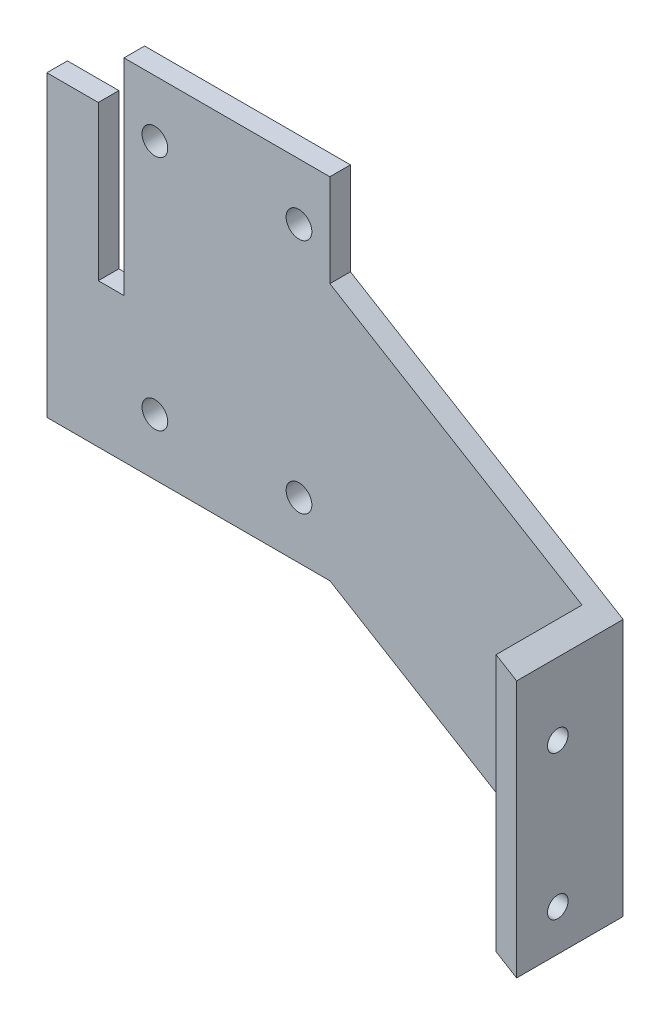
from build123d import *

# Parameters (mm, degrees)
SKETCH_1_R          = 2.5
EXTRUDE_1_DEPTH     = 4
EXTRUDE_2_DEPTH     = 16.7
SKETCH_3_R          = 2
CUT_EXTRUDE_1_DEPTH = 10
CUT_EXTRUDE_2_DEPTH = 10


with BuildPart() as part:
    # Эскиз1 → Бобышка-Вытянуть1 (new body)
    with BuildSketch(Plane.XY):
        Polygon((0, 0), (55, 0), (108, -32), (108, 0), (108, 18), (55, 50), (55, 68), (0, 68), align=None)
        with Locations((21, 57)):
            Circle(SKETCH_1_R, mode=Mode.SUBTRACT)
        with Locations((49, 57)):
            Circle(SKETCH_1_R, mode=Mode.SUBTRACT)
        with Locations((21, 11)):
            Circle(SKETCH_1_R, mode=Mode.SUBTRACT)
        with Locations((49, 11)):
            Circle(SKETCH_1_R, mode=Mode.SUBTRACT)
        with Locations((93, 0)):
            Circle(SKETCH_1_R, mode=Mode.SUBTRACT)
    extrude(amount=EXTRUDE_1_DEPTH)

    # Эскиз2 → Бобышка-Вытянуть2 (add)
    with BuildSketch(Plane.XY.offset(4)):
        Polygon((108, 18), (108, -32), (104, -29.58490566), (104, 20.41509434), align=None)
    extrude(amount=EXTRUDE_2_DEPTH)

    # Эскиз3 → Вырез-Вытянуть1 (cut)
    with BuildSketch(Plane(origin=(108, 0, 0), x_dir=(0, 0, -1), z_dir=(1, 0, 0))):
        with Locations((-12.7, 4)):
            Circle(SKETCH_3_R)
        with Locations((-12.7, -24)):
            Circle(SKETCH_3_R)
    extrude(amount=-CUT_EXTRUDE_1_DEPTH, mode=Mode.SUBTRACT)

    # Эскиз4 → Вырез-Вытянуть2 (cut)
    with BuildSketch(Plane.XY.offset(4)):
        Polygon((0, 68), (15, 68), (15, 58), (15, 28), (10, 28), (10, 58), (0, 58), align=None)
    extrude(amount=-CUT_EXTRUDE_2_DEPTH, mode=Mode.SUBTRACT)


solid = part.part
